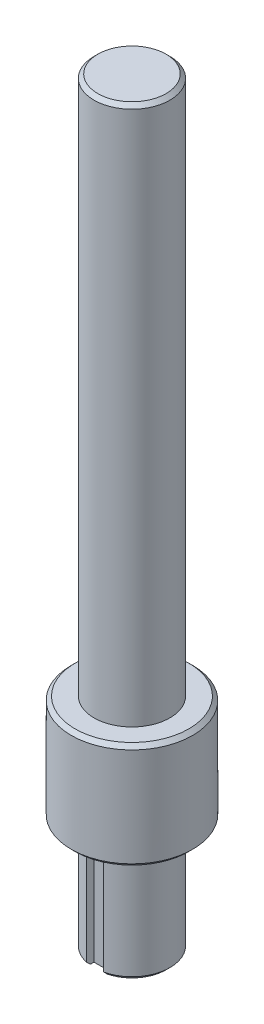
from build123d import *

# Parameters (mm, degrees)
SKETCH2_W          = 2.25
SKETCH2_H          = 2.25
CUT_EXTRUDE1_DEPTH = 15
CHAMFER1_SIZE      = 0.5
CHAMFER2_SIZE      = 0.5


with BuildPart() as part:
    # Sketch1 → Revolve1 (revolve)
    with BuildSketch(Plane.XY, mode=Mode.PRIVATE) as revolve1_sk:
        Polygon((0, 0), (5, 0), (5, 15), (8, 15), (8, 29), (5, 29), (5, 100), (0, 100), align=None)
    revolve(revolve1_sk.sketch.rotate(Axis((0, 100, 0), (0, -1, 0)), 180), axis=Axis((0, 100, 0), (0, -1, 0)))

    # Sketch2 → Cut-Extrude1 (cut)
    with BuildSketch(Plane.XZ):
        with Locations((0, 5)):
            Rectangle(SKETCH2_W, SKETCH2_H)
    extrude(amount=-CUT_EXTRUDE1_DEPTH, mode=Mode.SUBTRACT)

    # Chamfer1
    chamfer1_edges = [part.edges().sort_by_distance(p)[0] for p in [
        (8, 29, 0),
        (8, 15, 0),
    ]]
    chamfer(chamfer1_edges, length=CHAMFER1_SIZE)

    # Chamfer2
    chamfer2_edges = [part.edges().sort_by_distance(p)[0] for p in [
        (0, 0, -5),
        (5, 100, 0),
    ]]
    chamfer(chamfer2_edges, length=CHAMFER2_SIZE)


solid = part.part
